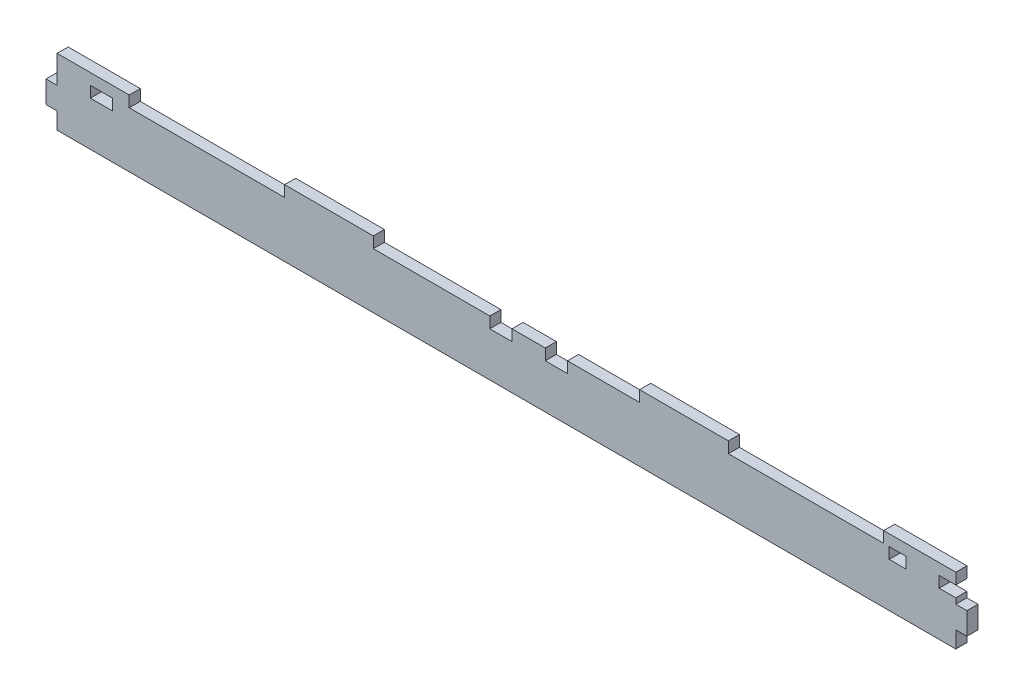
from build123d import *

# Parameters (mm, degrees)
SKETCH1_W           = 7.5
SKETCH1_H           = 5
SKETCH1_W_2         = 10
BOSS_EXTRUDE1_DEPTH = 5


with BuildPart() as part:
    # Sketch1 → Boss-Extrude1 (new body)
    with BuildSketch(Plane.XY):
        Polygon((480, 177.5), (485, 177.5), (485, 187.5), (480, 187.5), (480, 190), (472.5, 190), (472.5, 195), (480, 195), (480, 200), (447.5, 200), (447.5, 195), (377.5, 195), (377.5, 200), (337.5, 200), (337.5, 195), (305, 195), (305, 190), (295, 190), (295, 195), (280, 195), (280, 190), (270, 190), (270, 195), (217.5, 195), (217.5, 200), (177.5, 200), (177.5, 195), (107.5, 195), (107.5, 200), (75, 200), (75, 195), (75, 187.5), (70, 187.5), (70, 177.5), (75, 177.5), (75, 170), (480, 170), align=None)
        with Locations((453.75, 192.5)):
            Rectangle(SKETCH1_W, SKETCH1_H, mode=Mode.SUBTRACT)
        with Locations((95, 192.5)):
            Rectangle(SKETCH1_W_2, SKETCH1_H, mode=Mode.SUBTRACT)
    extrude(amount=BOSS_EXTRUDE1_DEPTH)


solid = part.part
